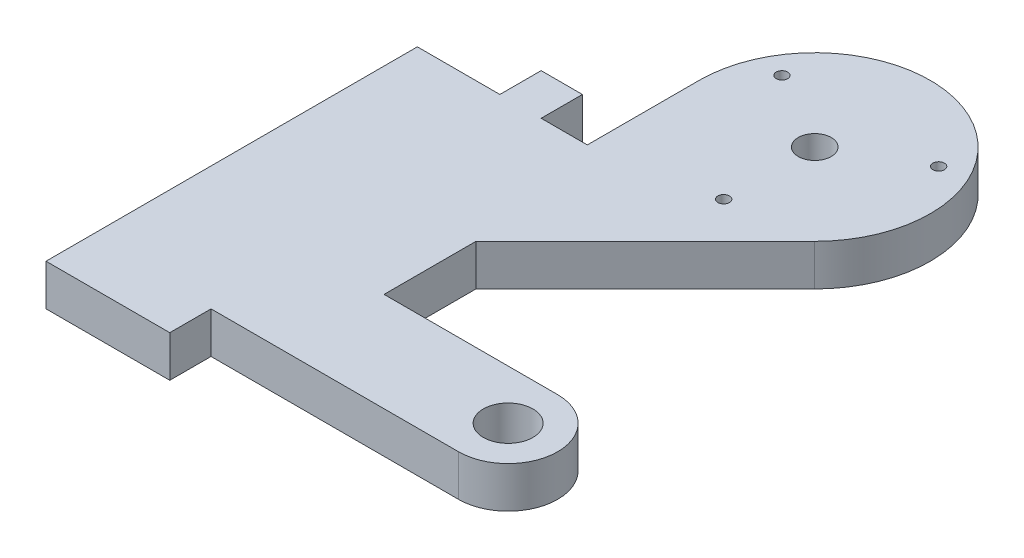
from build123d import *

# Parameters (mm, degrees)
SKETCH2_R           = 14
SKETCH2_R_2         = 2
SKETCH2_R_3         = 0.7
SKETCH2_W           = 5
SKETCH2_H           = 5
SKETCH2_R_4         = 3
SKETCH2_W_2         = 15
BOSS_EXTRUDE2_DEPTH = 5


with BuildPart() as part:
    # Sketch2 → Boss-Extrude2 (new body)
    # profile 1 of 6: a face of its own
    with BuildSketch(Plane(origin=(0, 0, 0), x_dir=(1, 0, 0), z_dir=(0, 1, 0))):
        with Locations((34.59438676, 53.562546918)):
            Circle(SKETCH2_R)
        with Locations(Location((34.59438676, 53.562546918, 0), (0, 0, 270))):
            Circle(SKETCH2_R_2, mode=Mode.SUBTRACT)
        with Locations(Location((34.557412927, 42.562609058, 0), (0, 0, 270))):
            Circle(SKETCH2_R_3, mode=Mode.SUBTRACT)
        with Locations(Location((25.086648049, 59.094536127, 0), (0, 0, 270))):
            Circle(SKETCH2_R_3, mode=Mode.SUBTRACT)
        with Locations(Location((44.139099303, 59.03049557, 0), (0, 0, 270))):
            Circle(SKETCH2_R_3, mode=Mode.SUBTRACT)
    # profile 2 of 6: a face of its own
    with BuildSketch(Plane(origin=(0, 0, 0), x_dir=(1, 0, 0), z_dir=(0, 1, 0))):
        with BuildLine():
            ThreePointArc((44.493881696, 43.663051982), (29.236818707, 40.628233463), (20.59438676, 53.562546918))
            Line((20.59438676, 53.562546918), (20.59438676, 40))
            Line((20.59438676, 40), (23.964739417, 40))
            Line((23.964739417, 40), (23.964739417, 23.133909702))
            Line((23.964739417, 23.133909702), (27.177730802, 26.346901087))
            Line((27.177730802, 26.346901087), (44.493881696, 43.663051982))
        make_face()
    # profile 3 of 6: a face of its own
    with BuildSketch(Plane(origin=(0, 0, 0), x_dir=(1, 0, 0), z_dir=(0, 1, 0))):
        Polygon((23.964739417, 40), (20.59438676, 40), (15, 40), (10, 40), (0, 40), (0, 0), (15, 0), (23.964739417, 0), (23.964739417, 12), (23.964739417, 23.133909702), align=None)
    # profile 4 of 6: a face of its own
    with BuildSketch(Plane(origin=(0, 0, 0), x_dir=(1, 0, 0), z_dir=(0, 1, 0))):
        with Locations((12.5, 42.5)):
            Rectangle(SKETCH2_W, SKETCH2_H)
    # profile 5 of 6: a face of its own
    with BuildSketch(Plane(origin=(0, 0, 0), x_dir=(1, 0, 0), z_dir=(0, 1, 0))):
        with BuildLine():
            Line((45, 12), (23.964739417, 12))
            Line((23.964739417, 12), (23.964739417, 0))
            Line((23.964739417, 0), (45, 0))
            ThreePointArc((45, 0), (51, 6), (45, 12))
        make_face()
        with Locations(Location((45, 6, 0), (0, 0, 270))):
            Circle(SKETCH2_R_4, mode=Mode.SUBTRACT)
    # profile 6 of 6: a face of its own
    with BuildSketch(Plane(origin=(0, 0, 0), x_dir=(1, 0, 0), z_dir=(0, 1, 0))):
        with Locations((7.5, -2.5)):
            Rectangle(SKETCH2_W_2, SKETCH2_H)
    extrude(amount=BOSS_EXTRUDE2_DEPTH)


solid = part.part
